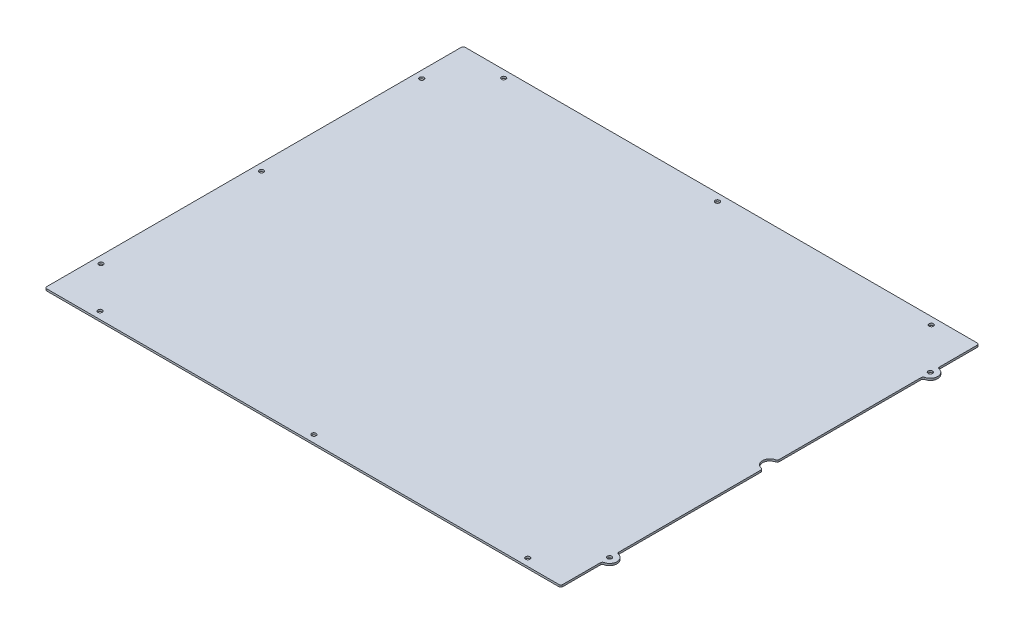
from build123d import *

# Parameters (mm, degrees)
BOSS_EXTRUDE1_DEPTH        = 2.54
F_1_0_228_DIAMETER_HOLE1_D = 5.7912
FILLET1_R                  = 2.54
F_1_0_228_DIAMETER_HOLE2_D = 5.7912


with BuildPart() as part:
    # Sketch1 → Boss-Extrude1 (new body)
    with BuildSketch(Plane(origin=(0, 0, 0), x_dir=(1, 0, 0), z_dir=(0, 1, 0))):
        with BuildLine():
            Line((-341.884, -273.304), (332.232, -273.304))
            Line((332.232, -273.304), (332.232, -219.202))
            ThreePointArc((332.232, -219.202), (341.884, -209.55), (332.232, -199.898))
            Line((332.232, -199.898), (332.232, -9.652))
            ThreePointArc((332.232, -9.652), (322.58, 0), (332.232, 9.652))
            Line((332.232, 9.652), (332.232, 199.898))
            ThreePointArc((332.232, 199.898), (341.884, 209.55), (332.232, 219.202))
            Line((332.232, 219.202), (332.232, 273.304))
            Line((332.232, 273.304), (-341.884, 273.304))
            Line((-341.884, 273.304), (-341.884, -273.304))
        make_face()
    extrude(amount=BOSS_EXTRUDE1_DEPTH)

    # #1 (0.228) Diameter Hole1 (through all)
    with Locations(Plane(origin=(0, 2.54, 0), x_dir=(1, 0, 0), z_dir=(0, 1, 0))):
        with Locations((332.232, 209.55), (332.232, -209.55)):
            Hole(F_1_0_228_DIAMETER_HOLE1_D / 2)

    # Fillet1
    fillet1_edges = [part.edges().sort_by_distance(p)[0] for p in [
        (-341.884, 1.27, -273.304),
        (332.232, 1.27, -273.304),
        (332.232, 1.27, -219.202),
        (332.232, 1.27, -199.898),
        (332.232, 1.27, -9.652),
        (332.232, 1.27, 9.652),
        (332.232, 1.27, 199.898),
        (332.232, 1.27, 219.202),
        (332.232, 1.27, 273.304),
        (-341.884, 1.27, 273.304),
    ]]
    fillet(fillet1_edges, radius=FILLET1_R)

    # #1 (0.228) Diameter Hole2 (through all)
    with Locations(Plane(origin=(0, 0, 0), x_dir=(-1, 0, 0), z_dir=(0, -1, 0))):
        with Locations((-279.4, 263.652), (0, 263.652), (279.4, 263.652), (332.232, 209.55), (332.232, 0), (332.232, -209.55), (279.4, -263.652), (0, -263.652), (-279.4, -263.652)):
            Hole(F_1_0_228_DIAMETER_HOLE2_D / 2)


solid = part.part
